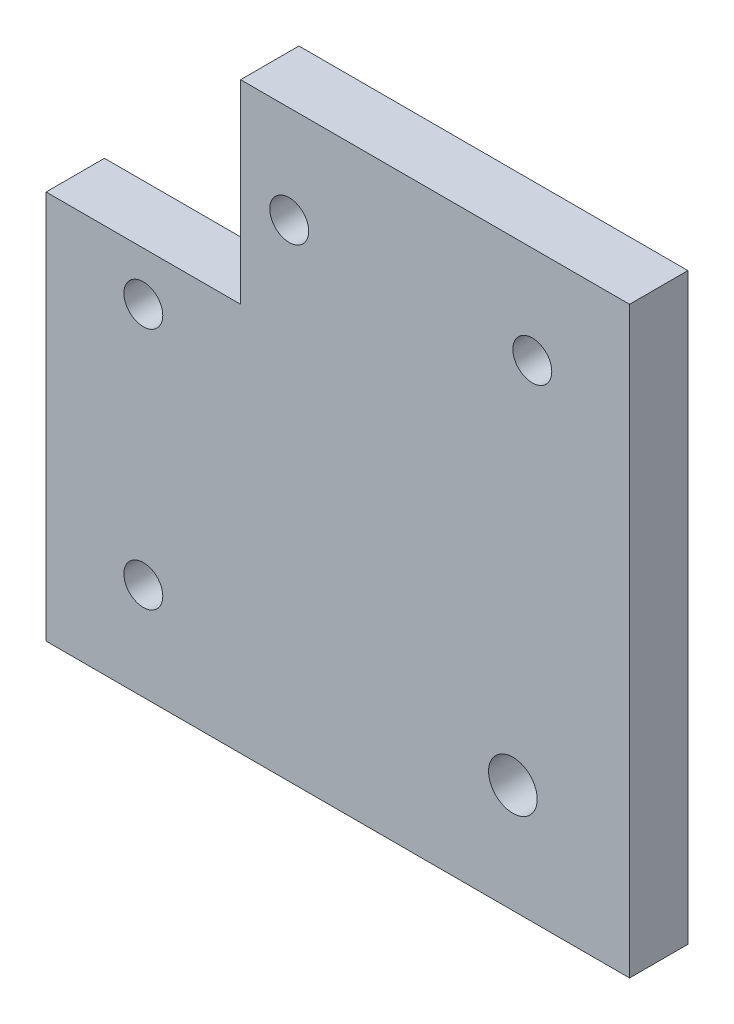
from build123d import *

# Parameters (mm, degrees)
SKETCH1_R           = 2
SKETCH1_R_2         = 2.5
BOSS_EXTRUDE1_DEPTH = 6


with BuildPart() as part:
    # Sketch1 → Boss-Extrude1 (new body)
    with BuildSketch(Plane.XY):
        Polygon((29.343145751, 0), (60, 0), (60, -20), (60, -60), (20, -60), (0, -60), (0, -29.343145751), (0, -20), (20, -20), (20, 0), align=None)
        with Locations((50, -10)):
            Circle(SKETCH1_R, mode=Mode.SUBTRACT)
        with Locations((25, -10)):
            Circle(SKETCH1_R, mode=Mode.SUBTRACT)
        with Locations((10, -50)):
            Circle(SKETCH1_R, mode=Mode.SUBTRACT)
        with Locations((10, -25)):
            Circle(SKETCH1_R, mode=Mode.SUBTRACT)
        with Locations((48, -48.833248844)):
            Circle(SKETCH1_R_2, mode=Mode.SUBTRACT)
    extrude(amount=BOSS_EXTRUDE1_DEPTH)


solid = part.part
